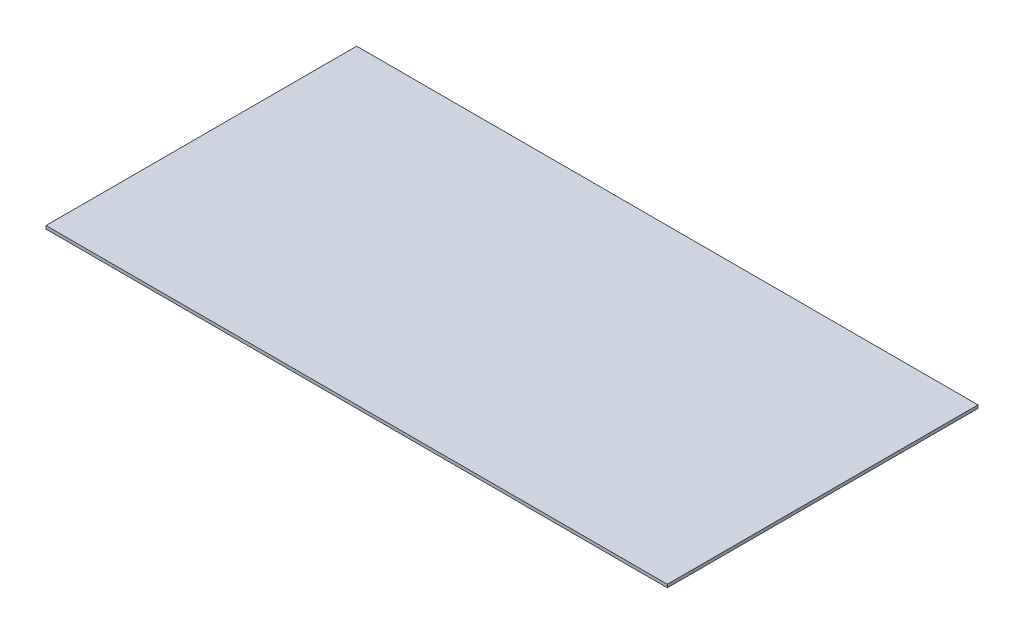
from build123d import *

# Parameters (mm, degrees)
SKETCH1_W           = 40
SKETCH1_H           = 20
BOSS_EXTRUDE1_DEPTH = 0.2


with BuildPart() as part:
    # Sketch1 → Boss-Extrude1 (new body)
    with BuildSketch(Plane(origin=(0, 0, 0), x_dir=(1, 0, 0), z_dir=(0, 1, 0))):
        Rectangle(SKETCH1_W, SKETCH1_H)
    extrude(amount=BOSS_EXTRUDE1_DEPTH)


solid = part.part
